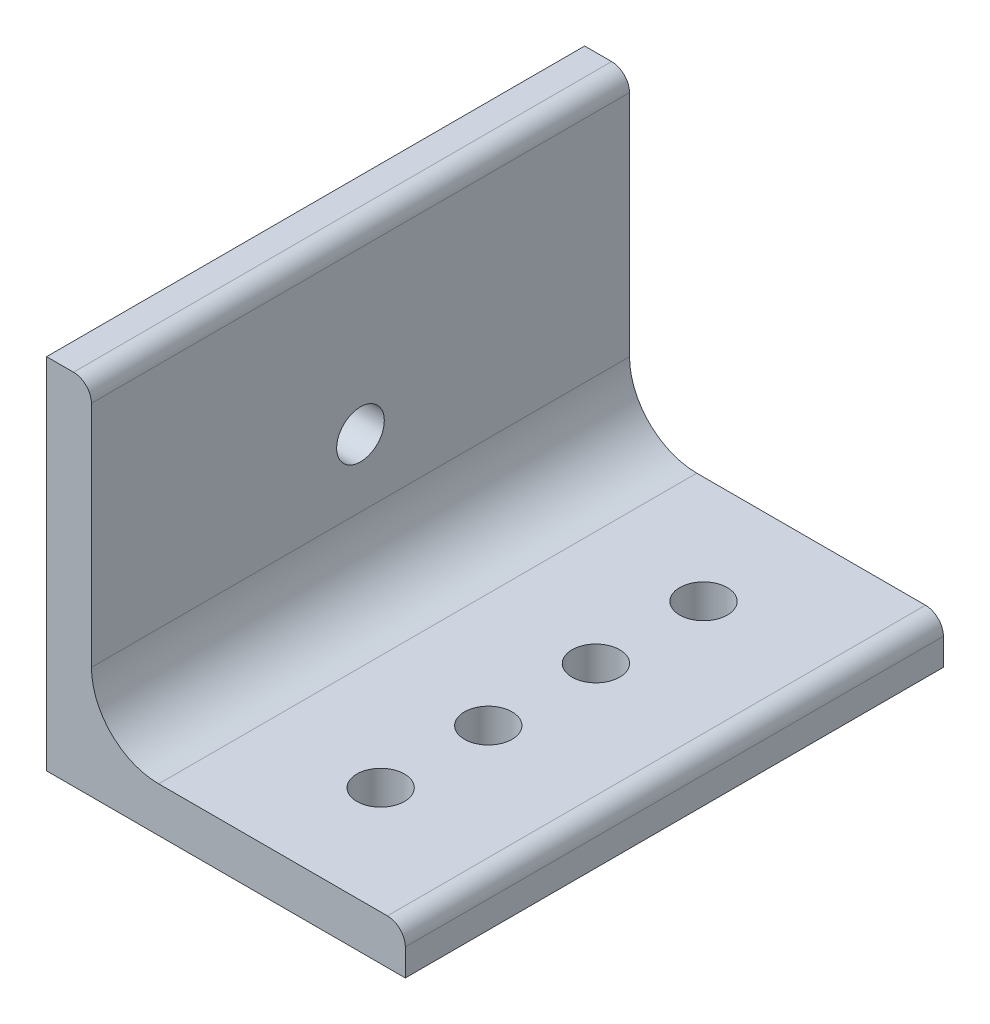
from build123d import *

# Parameters (mm, degrees)
BOSS_EXTRUDE1_DEPTH      = 76.2
BOSS_EXTRUDE1_DEPTH_BACK = 76.2
M12_CLEARANCE_HOLE1_D    = 13.5
F_1_2_CLEARANCE_HOLE1_D  = 13.49248


with BuildPart() as part:
    # Sketch3 → Boss-Extrude1 (new, two sides: drawn at the far end of the back side and taken through both)
    with BuildSketch(Plane.XY.offset(-BOSS_EXTRUDE1_DEPTH_BACK)):
        with BuildLine():
            Line((0, 19.05), (0, 83.82))
            ThreePointArc((0, 83.82), (-1.487897552, 87.412102448), (-5.08, 88.9))
            Line((-5.08, 88.9), (-12.7, 88.9))
            Line((-12.7, 88.9), (-12.7, -12.7))
            Line((-12.7, -12.7), (88.9, -12.7))
            Line((88.9, -12.7), (88.9, -5.08))
            ThreePointArc((88.9, -5.08), (87.412102448, -1.487897552), (83.82, 0))
            Line((83.82, 0), (19.05, 0))
            ThreePointArc((19.05, 0), (5.579615818, 5.579615818), (0, 19.05))
        make_face()
    extrude(amount=BOSS_EXTRUDE1_DEPTH + BOSS_EXTRUDE1_DEPTH_BACK)

    # M12 Clearance Hole1 (through all)
    with Locations(Plane(origin=(0, 0, 0), x_dir=(0, 0, -1), z_dir=(1, 0, 0))):
        with Locations((0, 38.1)):
            Hole(M12_CLEARANCE_HOLE1_D / 2)

    # 1/2 Clearance Hole1 (through all)
    with Locations(Plane(origin=(0, 0, 0), x_dir=(1, 0, 0), z_dir=(0, 1, 0))):
        with Locations((51.435, -45.72), (51.435, 45.72), (51.435, 15.24), (51.435, -15.24)):
            Hole(F_1_2_CLEARANCE_HOLE1_D / 2)


solid = part.part
